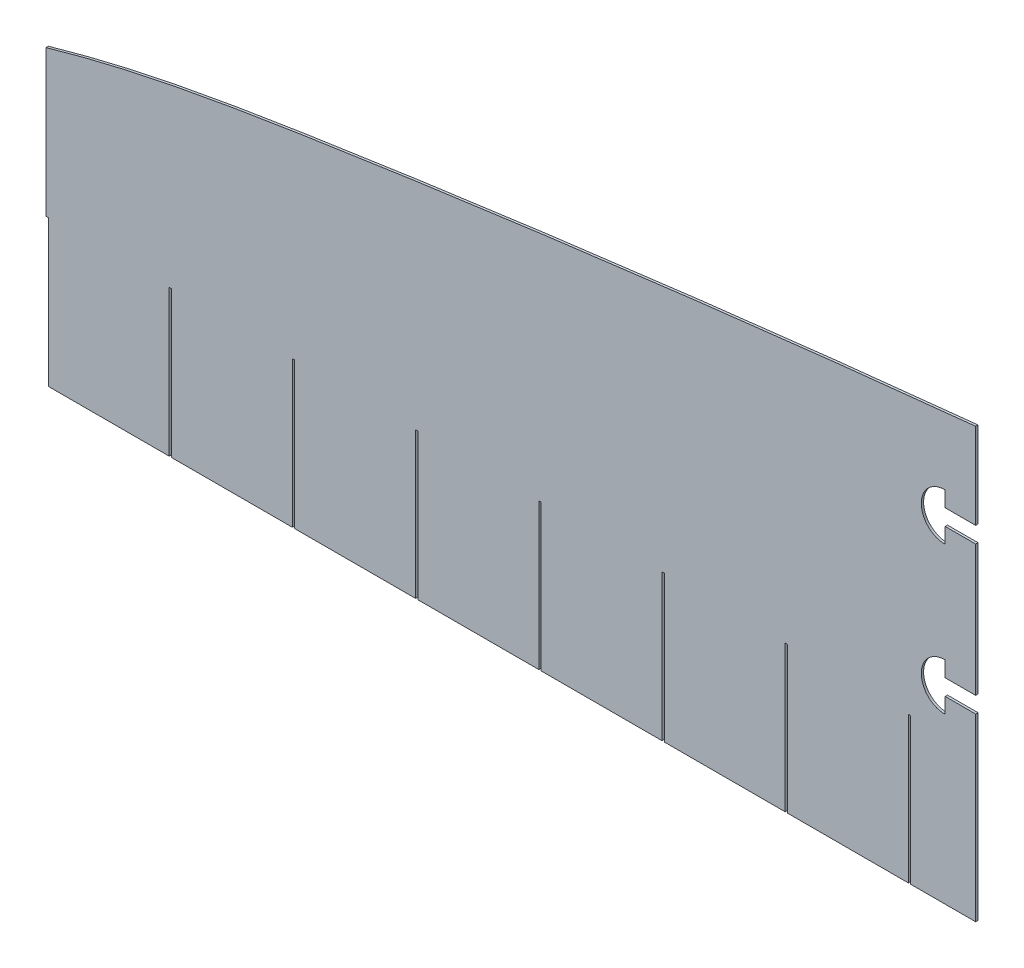
from build123d import *

# Parameters (mm, degrees)
BOSS_EXTRUDE1_DEPTH = 3


with BuildPart() as part:
    # Model → Boss-Extrude1 (new body)
    with BuildSketch(Plane.XY):
        with BuildLine():
            Line((1255.301037795, 443.027781841), (1294.701037823, 443.027781841))
            Line((1294.701037823, 443.027781841), (1294.701037823, 553.849315832))
            add(Edge.make_bspline(
                [(1294.701037823, 553.849315832), (987.9659757, 523.139532485), (557.602899882, 467.780280961), (240.864040275, 415.199018527), (137.973344874, 389.690933183), (94.901037796, 377.220662508)],
                knots=[0.108777165, 0.108777165, 0.108777165, 0.108777165, 0.189662497, 0.216203451, 0.238160454, 0.238160454, 0.238160454, 0.238160454], degree=3))
            Line((94.901037796, 377.220662508), (94.901037796, 188.610331254))
            Line((94.901037796, 188.610331254), (97.901037796, 188.610331254))
            Line((97.901037796, 188.610331254), (97.901037796, 0))
            Line((97.901037796, 0), (253.901037796, 0))
            Line((253.901037796, 0), (253.901037796, 188.610331254))
            Line((253.901037796, 188.610331254), (256.901037795, 188.610331254))
            Line((256.901037795, 188.610331254), (256.901037795, 0))
            Line((256.901037795, 0), (412.901037795, 0))
            Line((412.901037795, 0), (412.901037795, 188.610331254))
            Line((412.901037795, 188.610331254), (415.901037795, 188.610331254))
            Line((415.901037795, 188.610331254), (415.901037795, 0))
            Line((415.901037795, 0), (571.901037795, 0))
            Line((571.901037795, 0), (571.901037795, 188.610331254))
            Line((571.901037795, 188.610331254), (574.901037795, 188.610331254))
            Line((574.901037795, 188.610331254), (574.901037795, 0))
            Line((574.901037795, 0), (730.901037795, 0))
            Line((730.901037795, 0), (730.901037795, 188.610331254))
            Line((730.901037795, 188.610331254), (733.901037795, 188.610331254))
            Line((733.901037795, 188.610331254), (733.901037795, 0))
            Line((733.901037795, 0), (889.901037795, 0))
            Line((889.901037795, 0), (889.901037795, 188.610331254))
            Line((889.901037795, 188.610331254), (892.901037795, 188.610331254))
            Line((892.901037795, 188.610331254), (892.901037795, 0))
            Line((892.901037795, 0), (1048.901037796, 0))
            Line((1048.901037796, 0), (1048.901037796, 188.610331254))
            Line((1048.901037796, 188.610331254), (1051.901037795, 188.610331254))
            Line((1051.901037795, 188.610331254), (1051.901037795, 0))
            Line((1051.901037795, 0), (1207.901037796, 0))
            Line((1207.901037796, 0), (1207.901037796, 188.610331254))
            Line((1207.901037796, 188.610331254), (1210.901037796, 188.610331254))
            Line((1210.901037796, 188.610331254), (1210.901037796, 0))
            Line((1210.901037796, 0), (1294.701037796, 0))
            Line((1294.701037796, 0), (1294.701037796, 232.227781841))
            Line((1294.701037796, 232.227781841), (1255.301037795, 232.227781841))
            Line((1255.301037795, 232.227781841), (1255.301037795, 212.230413534))
            ThreePointArc((1255.301037795, 212.230413534), (1224.501037792, 242.627781841), (1255.301037795, 273.025150148))
            Line((1255.301037795, 273.025150148), (1255.301037795, 253.027781841))
            Line((1255.301037795, 253.027781841), (1294.701037796, 253.027781841))
            Line((1294.701037796, 253.027781841), (1294.701037796, 422.227781841))
            Line((1294.701037796, 422.227781841), (1255.301037795, 422.227781841))
            Line((1255.301037795, 422.227781841), (1255.301037795, 402.230413534))
            ThreePointArc((1255.301037795, 402.230413534), (1224.501037792, 432.627781841), (1255.301037795, 463.025150148))
            Line((1255.301037795, 463.025150148), (1255.301037795, 443.027781841))
        make_face()
    extrude(amount=BOSS_EXTRUDE1_DEPTH)


solid = part.part
